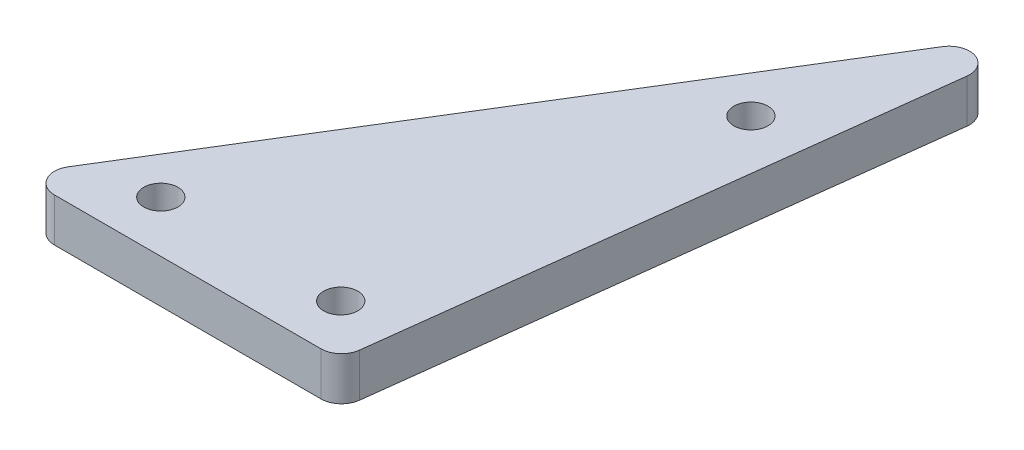
from build123d import *

# Parameters (mm, degrees)
BOSS_EXTRUDE1_DEPTH = 6.35
SKETCH2_R           = 2.5
CUT_EXTRUDE1_DEPTH  = 103.686827993


with BuildPart() as part:
    # Sketch1 → Boss-Extrude1 (new body)
    with BuildSketch(Plane(origin=(0, 0, 0), x_dir=(1, 0, 0), z_dir=(0, 1, 0))):
        with BuildLine():
            Line((5.368406408, 0), (44.345824206, 0))
            ThreePointArc((44.345824206, 0), (46.333684351, 0.753132838), (47.323462661, 2.63439197))
            Line((47.323462661, 2.63439197), (57.040137924, 81.77036144))
            ThreePointArc((57.040137924, 81.77036144), (55.05416359, 84.967329968), (51.507452969, 83.708145472))
            Line((51.507452969, 83.708145472), (2.813359907, 4.572176002))
            ThreePointArc((2.813359907, 4.572176002), (2.749577661, 1.536532885), (5.368406408, 0))
        make_face()
    extrude(amount=BOSS_EXTRUDE1_DEPTH)

    # Sketch2 → Cut-Extrude1 (cut, through all)
    with BuildSketch(Plane(origin=(0, 6.35, 0), x_dir=(1, 0, 0), z_dir=(0, 1, 0))):
        with Locations(Location((13.421016019, 7.5, 0), (0, 0, 270))):
            Circle(SKETCH2_R)
        with Locations(Location((46.29547273, 60.926439205, 0), (0, 0, 270))):
            Circle(SKETCH2_R)
        with Locations(Location((39.735530851, 7.5, 0), (0, 0, 270))):
            Circle(SKETCH2_R)
    extrude(amount=-CUT_EXTRUDE1_DEPTH, mode=Mode.SUBTRACT)


solid = part.part
